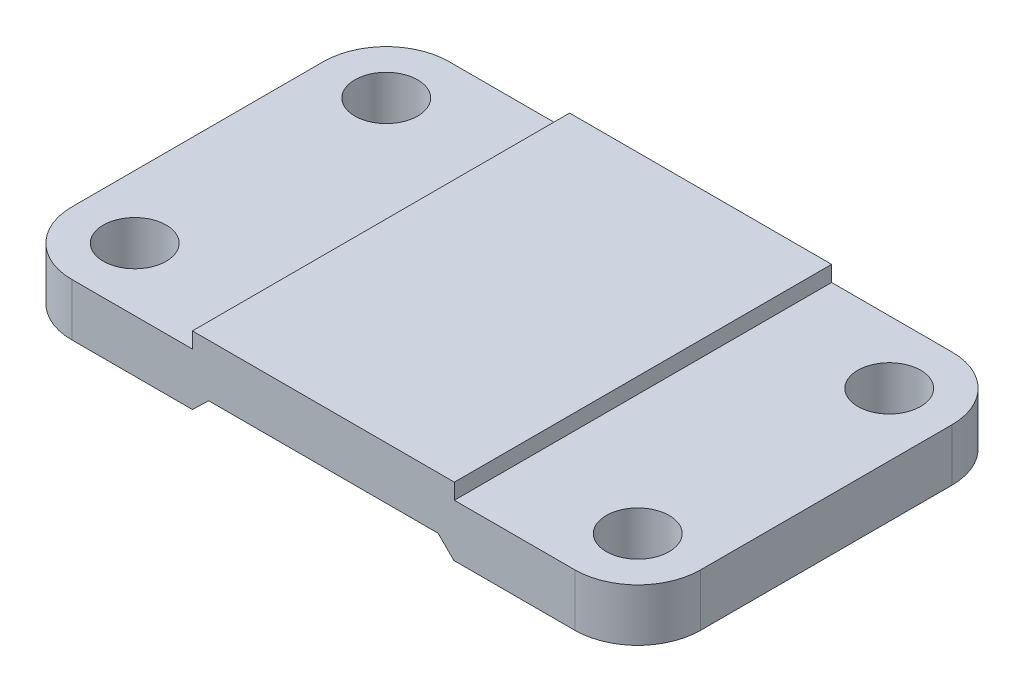
from build123d import *

# Parameters (mm, degrees)
SKETCH1_R           = 6
BOSS_EXTRUDE1_DEPTH = 10
BOSS_EXTRUDE2_DEPTH = 3
CUT_EXTRUDE6_DEPTH  = 500


with BuildPart() as part:
    # Sketch1 → Boss-Extrude1 (new body)
    with BuildSketch(Plane(origin=(0, 0, 0), x_dir=(1, 0, 0), z_dir=(0, 1, 0))):
        with BuildLine():
            Line((0, 36), (48, 36))
            ThreePointArc((48, 36), (56.485281374, 32.485281374), (60, 24))
            Line((60, 24), (60, -24))
            ThreePointArc((60, -24), (56.485281374, -32.485281374), (48, -36))
            Line((48, -36), (-48, -36))
            ThreePointArc((-48, -36), (-56.485281374, -32.485281374), (-60, -24))
            Line((-60, -24), (-60, 24))
            ThreePointArc((-60, 24), (-56.485281374, 32.485281374), (-48, 36))
            Line((-48, 36), (0, 36))
        make_face()
        with Locations(Location((-48, 24, 0), (0, 0, 270))):
            Circle(SKETCH1_R, mode=Mode.SUBTRACT)
        with Locations(Location((48, 24, 0), (0, 0, 90))):
            Circle(SKETCH1_R, mode=Mode.SUBTRACT)
        with Locations(Location((48, -24, 0), (0, 0, 270))):
            Circle(SKETCH1_R, mode=Mode.SUBTRACT)
        with Locations(Location((-48, -24, 0), (0, 0, 90))):
            Circle(SKETCH1_R, mode=Mode.SUBTRACT)
    extrude(amount=BOSS_EXTRUDE1_DEPTH)

    # Sketch2 → Boss-Extrude2 (add)
    with BuildSketch(Plane(origin=(0, 10, 0), x_dir=(1, 0, 0), z_dir=(0, 1, 0))):
        Polygon((-25, 36), (-25, 11.04169411), (-25, -36), (25, -36), (25, 36), align=None)
    extrude(amount=BOSS_EXTRUDE2_DEPTH)

    # Sketch7 → Cut-Extrude6 (cut)
    with BuildSketch(Plane.XY.offset(36)):
        Polygon((-21.898641014, 3), (21.9, 3), (24.9, 0), (-25, 0), align=None)
    extrude(amount=-CUT_EXTRUDE6_DEPTH, mode=Mode.SUBTRACT)


solid = part.part
